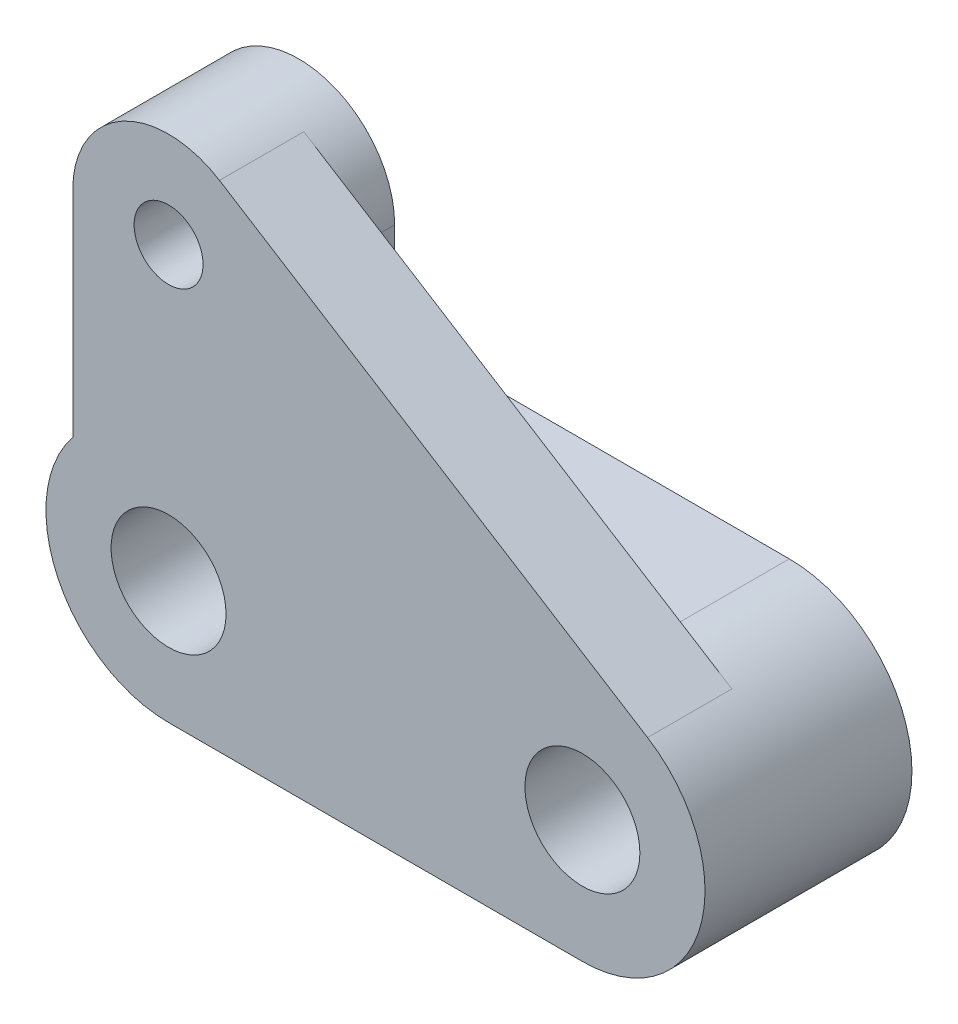
from build123d import *

# Parameters (mm, degrees)
SKETCH1_R           = 15
BOSS_EXTRUDE1_DEPTH = 27
BOSS_EXTRUDE3_DEPTH = 34
SKETCH2_3_R         = 9
CUT_EXTRUDE1_DEPTH  = 34
FILLET1_R           = 15
BOSS_EXTRUDE4_DEPTH = 22


with BuildPart() as part:
    # Sketch1 → Boss-Extrude1 (new, symmetric)
    with BuildSketch(Plane.XY):
        with BuildLine():
            Line((-108, 32), (0, 32))
            ThreePointArc((0, 32), (32, 0), (0, -32))
            Line((0, -32), (-108, -32))
            ThreePointArc((-108, -32), (-140, 0), (-108, 32))
        make_face()
        Circle(SKETCH1_R, mode=Mode.SUBTRACT)
        with Locations((-108, 0)):
            Circle(SKETCH1_R, mode=Mode.SUBTRACT)
    extrude(amount=BOSS_EXTRUDE1_DEPTH, both=True)

    # Sketch2 → Boss-Extrude3 (add)
    with BuildSketch(Plane.XY.offset(27)):
        with BuildLine():
            Line((-83, 76), (-83, 32))
            Line((-83, 32), (-108, 32))
            ThreePointArc((-108, 32), (-121.870841731, 28.837471278), (-133, 19.974984355))
            Line((-133, 19.974984355), (-133, 76))
            ThreePointArc((-133, 76), (-108, 101), (-83, 76))
        make_face()
    extrude(amount=-BOSS_EXTRUDE3_DEPTH)

    # Sketch2<3> → Cut-Extrude1 (cut)
    with BuildSketch(Plane.XY.offset(27)):
        with Locations((-108, 76)):
            Circle(SKETCH2_3_R)
    extrude(amount=-CUT_EXTRUDE1_DEPTH, mode=Mode.SUBTRACT)

    # Fillet1
    fillet1_edges = [part.edges().sort_by_distance(p)[0] for p in [
        (-83, 32, 10),
    ]]
    fillet(fillet1_edges, radius=FILLET1_R)

    # Sketch3 → Boss-Extrude4 (add)
    with BuildSketch(Plane.XY.offset(27)):
        with BuildLine():
            Line((-94.716606225, 97.17903326), (17.002744032, 27.109162572))
            ThreePointArc((17.002744032, 27.109162572), (8.846095118, 30.752993369), (0, 32))
            Line((0, 32), (-68, 32))
            ThreePointArc((-68, 32), (-78.606601718, 36.393398282), (-83, 47))
            Line((-83, 47), (-83, 76))
            ThreePointArc((-83, 76), (-86.124387501, 88.101965865), (-94.716606225, 97.17903326))
        make_face()
    extrude(amount=-BOSS_EXTRUDE4_DEPTH)


solid = part.part
